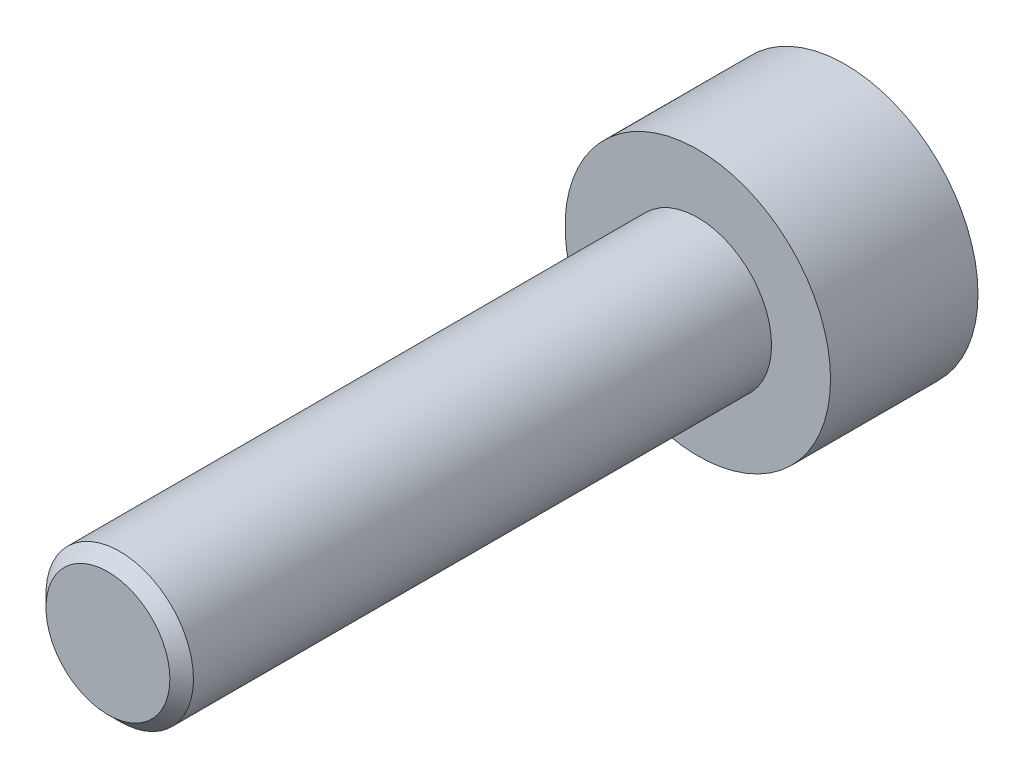
from build123d import *

# Parameters (mm, degrees)
SKETCH_1_R          = 2.25
EXTRUDE_1_DEPTH     = 2.5
SKETCH_2_R          = 1.25
EXTRUDE_2_DEPTH     = 10
CHAMFER_1_SIZE      = 0.2
CUT_EXTRUDE_1_DEPTH = 1.1


with BuildPart() as part:
    # 草图1 → 凸台-拉伸1 (new body)
    with BuildSketch(Plane.XY):
        Circle(SKETCH_1_R)
    extrude(amount=EXTRUDE_1_DEPTH)

    # 草图2 → 凸台-拉伸2 (add)
    with BuildSketch(Plane.XY.offset(2.5)):
        Circle(SKETCH_2_R)
    extrude(amount=EXTRUDE_2_DEPTH)

    # 倒角1
    chamfer_1_edges = [part.edges().sort_by_distance(p)[0] for p in [
        (-1.25, 0, 12.5),
    ]]
    chamfer(chamfer_1_edges, length=CHAMFER_1_SIZE)

    # 草图3 → 切除-拉伸1 (cut)
    with BuildSketch(Plane(origin=(0, 0, 0), x_dir=(-1, 0, 0), z_dir=(0, 0, -1))):
        Polygon((0, 1.177794549), (-1.02, 0.588897275), (-1.02, -0.588897275), (0, -1.177794549), (1.02, -0.588897275), (1.02, 0.588897275), align=None)
    extrude(amount=-CUT_EXTRUDE_1_DEPTH, mode=Mode.SUBTRACT)


solid = part.part
